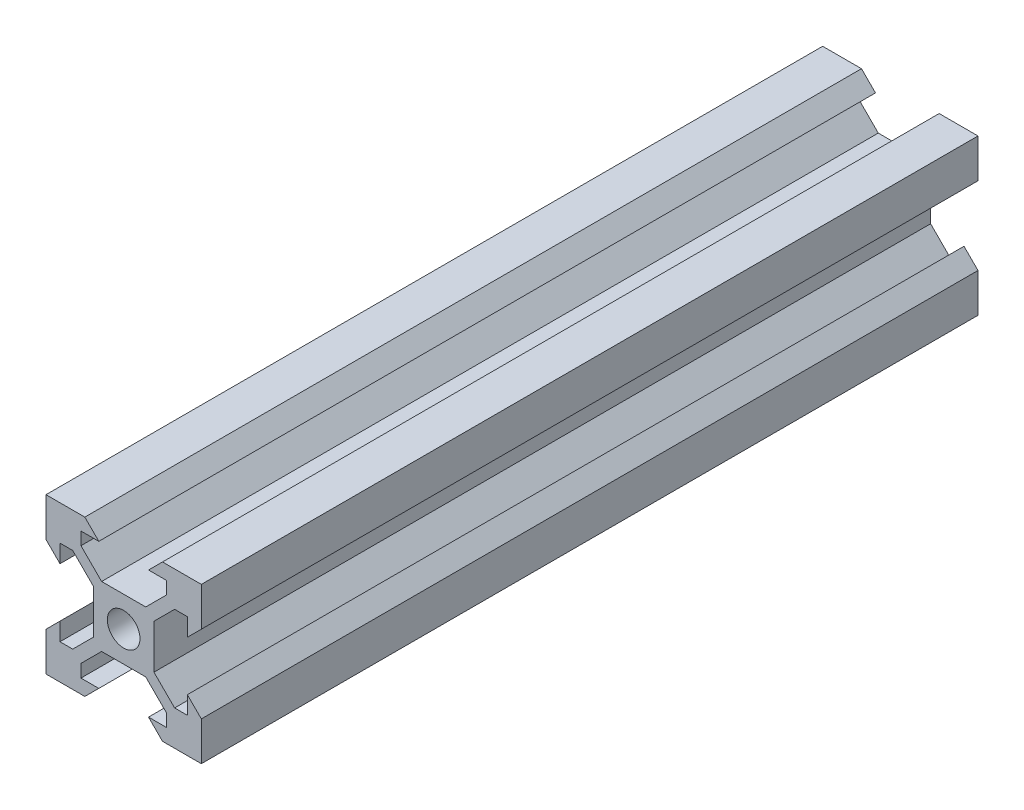
from build123d import *

# Parameters (mm, degrees)
SKETCH1_R           = 2.1
BOSS_EXTRUDE1_DEPTH = 100


with BuildPart() as part:
    # Sketch1 → Boss-Extrude1 (new body)
    with BuildSketch(Plane.XY):
        Polygon((-10, 10), (-10, 5), (-8.2, 3.2), (-8.2, 5.499339828), (-6.56, 5.499339828), (-3.900660172, 2.84), (-3.900660172, -2.84), (-6.56, -5.499339828), (-8.2, -5.499339828), (-8.2, -3.2), (-10, -5), (-10, -10), (-5, -10), (-3.2, -8.2), (-5.499339828, -8.2), (-5.499339828, -6.56), (-2.84, -3.900660172), (2.84, -3.900660172), (5.499339828, -6.56), (5.499339828, -8.2), (3.2, -8.2), (5, -10), (10, -10), (10, -5), (8.2, -3.2), (8.2, -5.499339828), (6.56, -5.499339828), (3.900660172, -2.84), (3.900660172, 2.84), (6.56, 5.499339828), (8.2, 5.499339828), (8.2, 3.2), (10, 5), (10, 10), (5, 10), (3.2, 8.2), (5.499339828, 8.2), (5.499339828, 6.56), (2.84, 3.900660172), (-2.84, 3.900660172), (-5.499339828, 6.56), (-5.499339828, 8.2), (-3.2, 8.2), (-5, 10), align=None)
        Circle(SKETCH1_R, mode=Mode.SUBTRACT)
    extrude(amount=-BOSS_EXTRUDE1_DEPTH)


solid = part.part
